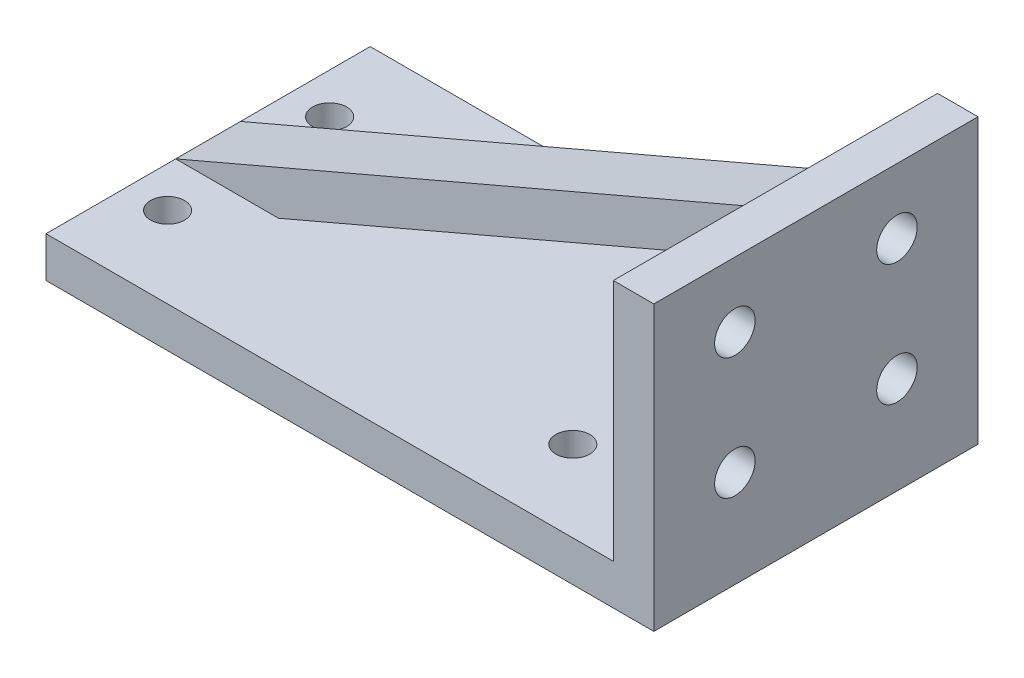
from build123d import *

# Parameters (mm, degrees)
BOSS_EXTRUDE1_DEPTH = 50.8
SKETCH4_R           = 2.667
CUT_EXTRUDE1_DEPTH  = 117.743329574
SKETCH5_W           = 88.9
SKETCH5_H           = 38.1
CUT_EXTRUDE2_DEPTH  = 20.32
SKETCH6_W           = 88.9
SKETCH6_H           = 38.1
CUT_EXTRUDE3_DEPTH  = 20.32
SKETCH7_R           = 3.175
CUT_EXTRUDE4_DEPTH  = 117.743329574


with BuildPart() as part:
    # Sketch3 → Boss-Extrude1 (new body)
    with BuildSketch(Plane.XY):
        Polygon((0, 6.35), (88.9, 44.45), (95.25, 44.45), (95.25, 0), (0, 0), align=None)
        Polygon((16.120053074, 6.35), (88.9, 6.35), (88.9, 37.541405825), align=None, mode=Mode.SUBTRACT)
    extrude(amount=BOSS_EXTRUDE1_DEPTH)

    # Sketch4 → Cut-Extrude1 (cut, through all)
    with BuildSketch(Plane.XZ):
        with Locations(Location((6.35, 38.1, 0), (0, 0, 270))):
            Circle(SKETCH4_R)
        with Locations(Location((6.35, 12.7, 0), (0, 0, 270))):
            Circle(SKETCH4_R)
        with Locations(Location((69.85, 12.7, 0), (0, 0, 270))):
            Circle(SKETCH4_R)
        with Locations(Location((69.85, 38.1, 0), (0, 0, 270))):
            Circle(SKETCH4_R)
    extrude(amount=-CUT_EXTRUDE1_DEPTH, mode=Mode.SUBTRACT)

    # Sketch5 → Cut-Extrude2 (cut)
    with BuildSketch(Plane.XY.offset(50.8)):
        with Locations((44.45, 25.4)):
            Rectangle(SKETCH5_W, SKETCH5_H)
    extrude(amount=-CUT_EXTRUDE2_DEPTH, mode=Mode.SUBTRACT)

    # Sketch6 → Cut-Extrude3 (cut)
    with BuildSketch(Plane(origin=(0, 0, 0), x_dir=(-1, 0, 0), z_dir=(0, 0, -1))):
        with Locations((-44.45, 25.4)):
            Rectangle(SKETCH6_W, SKETCH6_H)
    extrude(amount=-CUT_EXTRUDE3_DEPTH, mode=Mode.SUBTRACT)

    # Sketch7 → Cut-Extrude4 (cut, through all)
    with BuildSketch(Plane(origin=(95.25, 0, 0), x_dir=(0, 0, -1), z_dir=(1, 0, 0))):
        with Locations((-38.1, 15.24)):
            Circle(SKETCH7_R)
        with Locations((-12.7, 15.24)):
            Circle(SKETCH7_R)
        with Locations((-12.7, 34.29)):
            Circle(SKETCH7_R)
        with Locations((-38.1, 34.29)):
            Circle(SKETCH7_R)
    extrude(amount=-CUT_EXTRUDE4_DEPTH, mode=Mode.SUBTRACT)


solid = part.part
